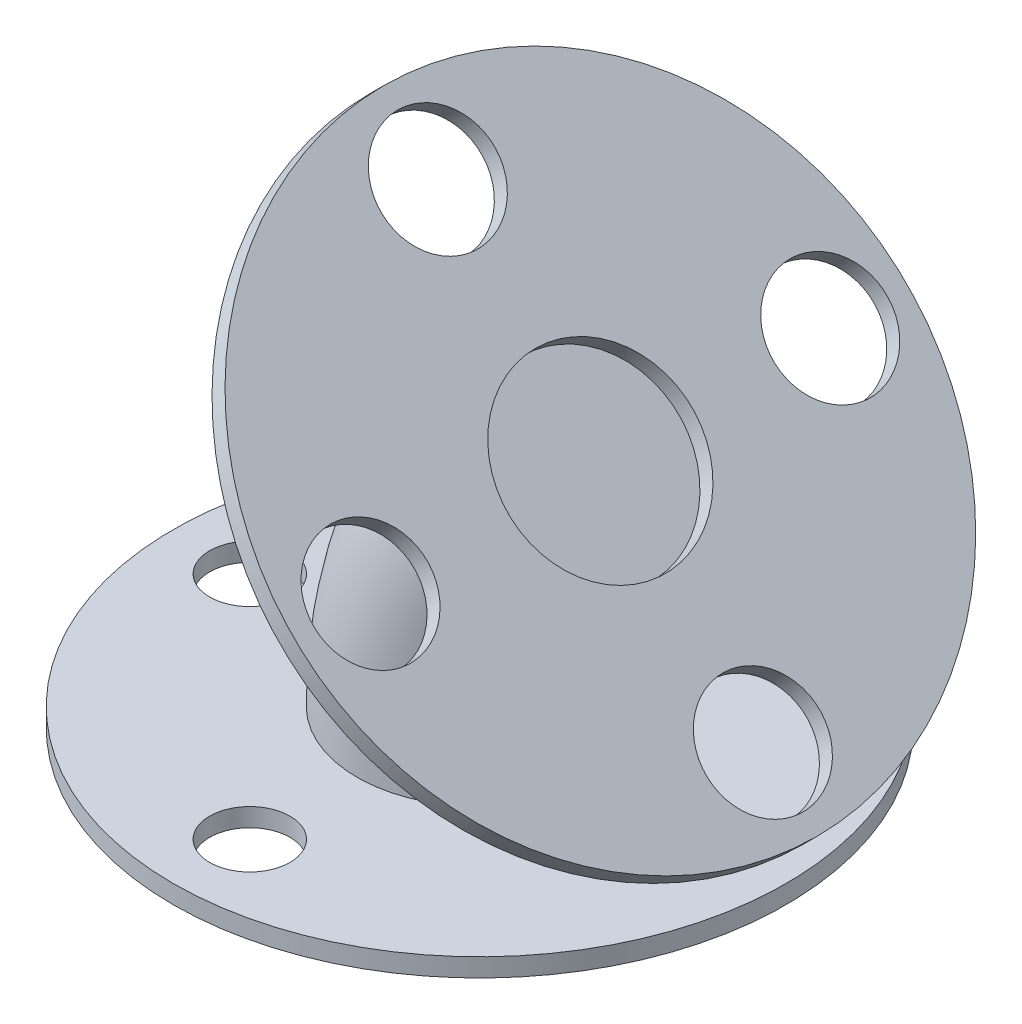
from build123d import *

# Parameters (mm, degrees)
SKETCH_2_R          = 20
SKETCH_5_R          = 50
EXTRUDE_1_DEPTH     = 3
SKETCH_6_R          = 15
SKETCH_6_R_2        = 9.261363372
CUT_EXTRUDE_1_DEPTH = 3
SKETCH_8_R          = 50
EXTRUDE_2_DEPTH     = 3
SKETCH_9_R          = 15
SKETCH_9_R_2        = 6.547134089
CUT_EXTRUDE_2_DEPTH = 3


with BuildPart() as part:
    # 扫描1: sweep along a path in 草图1
    with BuildLine(Plane.XY) as sweep_1_path:
        ThreePointArc((-42.426406871, 42.426406871), (-55.432771951, 22.961005942), (-60, 0))
    # 草图2 → 扫描1 (sweep)
    with BuildSketch(Plane(origin=(0, 0, 0), x_dir=(1, 0, 0), z_dir=(0, 1, 0))):
        with Locations((-60, 0)):
            Circle(SKETCH_2_R)
    sweep(path=sweep_1_path.line)

    # 草图5 → 凸台-拉伸1 (add)
    with BuildSketch(Plane(origin=(0, 0, 0), x_dir=(0, 0, -1), z_dir=(0.7071067811865434, 0.7071067811865517, 0))):
        with Locations(Location((0, 60, 0), (0, 0, 90))):
            Circle(SKETCH_5_R)
    extrude(amount=EXTRUDE_1_DEPTH)

    # 草图6 → 切除-拉伸1 (cut)
    with BuildSketch(Plane(origin=(2.121320344, 2.121320344, 0), x_dir=(0, 0, -1), z_dir=(0.7071067811865434, 0.7071067811865517, 0))):
        with Locations(Location((0, 60, 0), (0, 0, 90))):
            Circle(SKETCH_6_R)
        with Locations(Location((0, 97.5, 0), (0, 0, 90))):
            Circle(SKETCH_6_R_2)
        with Locations(Location((37.5, 60, 0), (0, 0, 90))):
            Circle(SKETCH_6_R_2)
        with Locations(Location((0, 22.5, 0), (0, 0, 90))):
            Circle(SKETCH_6_R_2)
        with Locations(Location((-37.5, 60, 0), (0, 0, 90))):
            Circle(SKETCH_6_R_2)
    extrude(amount=-CUT_EXTRUDE_1_DEPTH, mode=Mode.SUBTRACT)

    # 草图8 → 凸台-拉伸2 (add)
    with BuildSketch(Plane.XZ):
        with Locations(Location((-60, 0, 0), (0, 0, 270))):
            Circle(SKETCH_8_R)
    extrude(amount=EXTRUDE_2_DEPTH)

    # 草图9 → 切除-拉伸2 (cut)
    with BuildSketch(Plane.XZ.offset(3)):
        with Locations(Location((-60, 0, 0), (0, 0, 270))):
            Circle(SKETCH_9_R)
        with Locations(Location((-60, 37.5, 0), (0, 0, 270))):
            Circle(SKETCH_9_R_2)
        with Locations(Location((-22.5, 0, 0), (0, 0, 270))):
            Circle(SKETCH_9_R_2)
        with Locations(Location((-60, -37.5, 0), (0, 0, 270))):
            Circle(SKETCH_9_R_2)
        with Locations(Location((-97.5, 0, 0), (0, 0, 270))):
            Circle(SKETCH_9_R_2)
    extrude(amount=-CUT_EXTRUDE_2_DEPTH, mode=Mode.SUBTRACT)


solid = part.part
